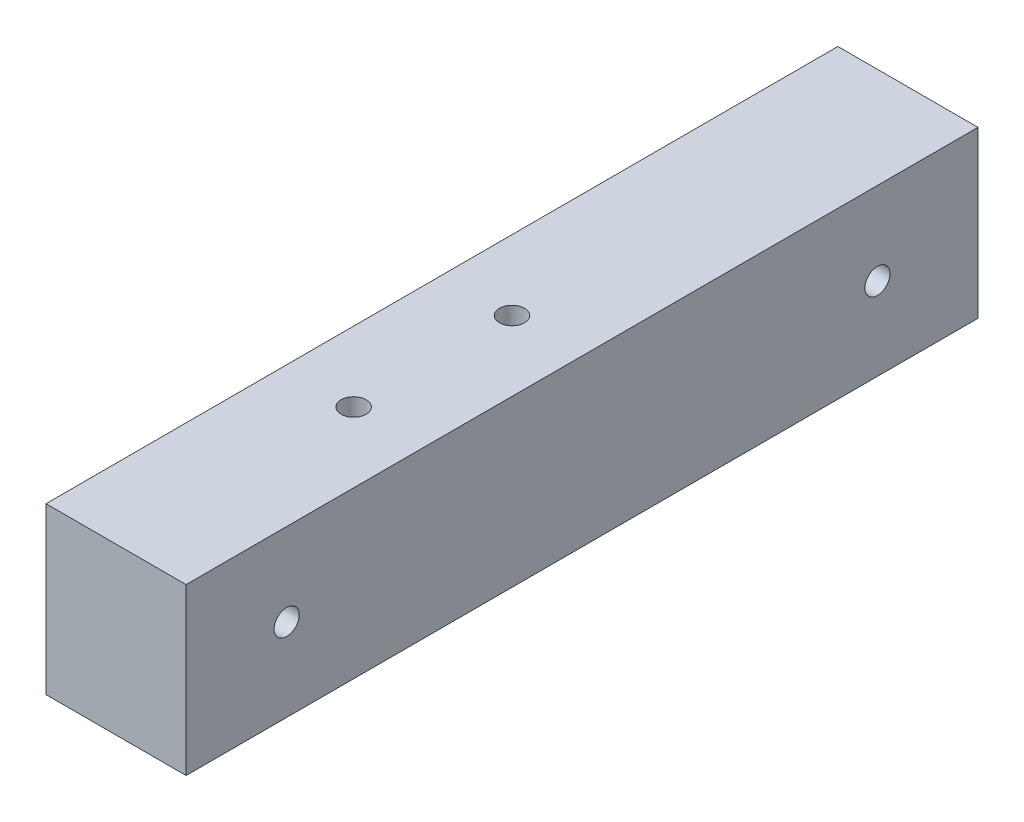
from build123d import *

# Parameters (mm, degrees)
SKETCH1_W           = 17.69
SKETCH1_H           = 20.88
BOSS_EXTRUDE1_DEPTH = 100
SKETCH2_R           = 1.5875
CUT_EXTRUDE1_DEPTH  = 106.78
SKETCH3_R           = 1.5875
CUT_EXTRUDE2_DEPTH  = 100


with BuildPart() as part:
    # Sketch1 → Boss-Extrude1 (new body)
    with BuildSketch(Plane.XY):
        with Locations((8.845, 10.44)):
            Rectangle(SKETCH1_W, SKETCH1_H)
    extrude(amount=BOSS_EXTRUDE1_DEPTH)

    # Sketch2 → Cut-Extrude1 (cut)
    with BuildSketch(Plane(origin=(0, 20.88, 0), x_dir=(1, 0, 0), z_dir=(0, 1, 0))):
        with Locations(Location((8.845, -50, 0), (0, 0, 270))):
            Circle(SKETCH2_R)
        with Locations(Location((8.845, -70, 0), (0, 0, 270))):
            Circle(SKETCH2_R)
    extrude(amount=-CUT_EXTRUDE1_DEPTH, mode=Mode.SUBTRACT)

    # Sketch3 → Cut-Extrude2 (cut)
    with BuildSketch(Plane(origin=(17.69, 0, 0), x_dir=(0, 0, -1), z_dir=(1, 0, 0))):
        with Locations(Location((-87.3, 10.44, 0), (0, 0, 90))):
            Circle(SKETCH3_R)
        with Locations(Location((-12.7, 10.44, 0), (0, 0, 90))):
            Circle(SKETCH3_R)
    extrude(amount=-CUT_EXTRUDE2_DEPTH, mode=Mode.SUBTRACT)


solid = part.part
